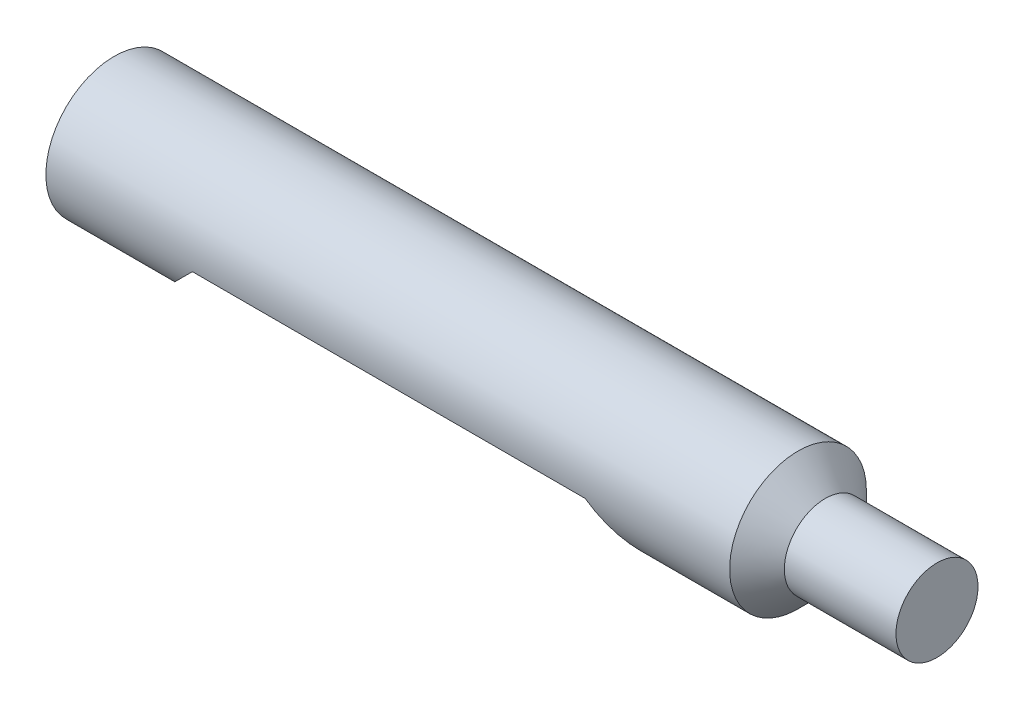
from build123d import *

# Parameters (mm, degrees)
CUT_EXTRUDE1_DEPTH = 17.5


with BuildPart() as part:
    # Sketch1 → Revolve1 (revolve)
    with BuildSketch(Plane.XY, mode=Mode.PRIVATE) as revolve1_sk:
        Polygon((0, 0), (0, 5), (50, 5), (52, 3), (60.162162162, 3), (60.162162162, 0), align=None)
    revolve(revolve1_sk.sketch.rotate(Axis((60.162162162, 0, 0), (-1, 0, 0)), 90), axis=Axis((60.162162162, 0, 0), (-1, 0, 0)))

    # Sketch2 → Cut-Extrude1 (cut, symmetric)
    with BuildSketch(Plane.XY):
        Polygon((6.5, -5), (10.64, -0.86), (39.36, -0.86), (43.5, -5), align=None)
    extrude(amount=CUT_EXTRUDE1_DEPTH, both=True, mode=Mode.SUBTRACT)


solid = part.part
